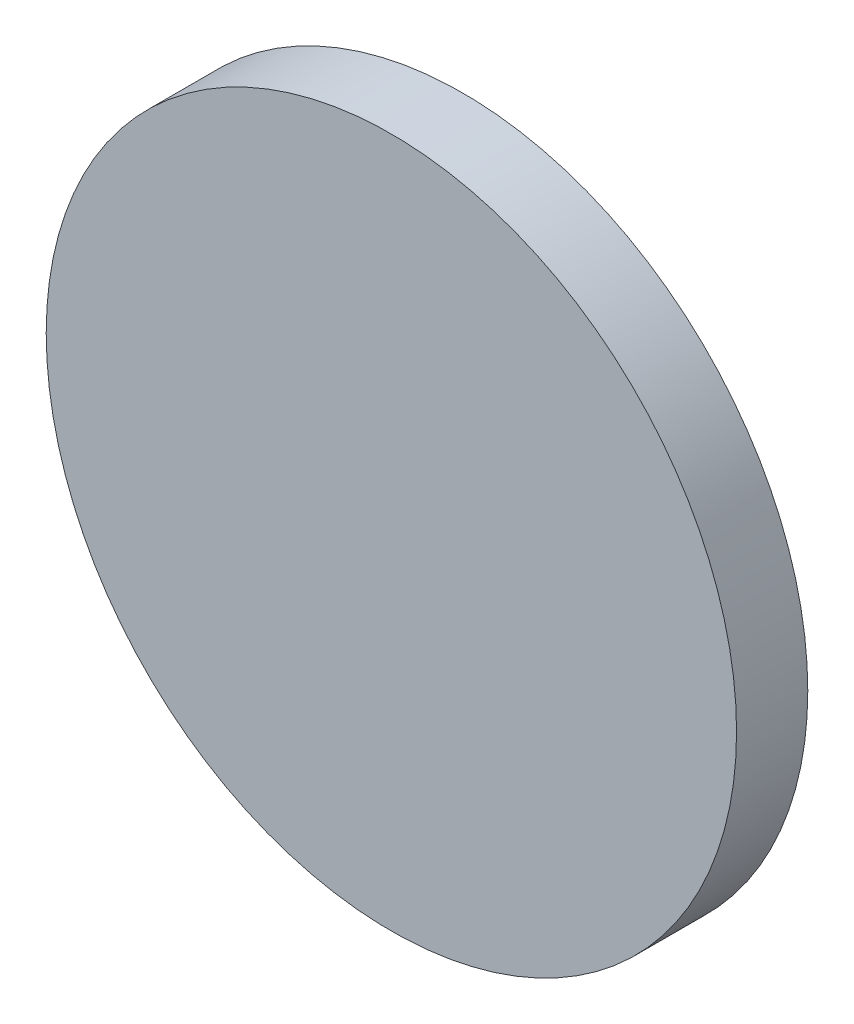
from build123d import *

# Parameters (mm, degrees)
SKETCH2_R           = 16.002
BOSS_EXTRUDE2_DEPTH = 3.302


with BuildPart() as part:
    # Sketch2 → Boss-Extrude2 (new body)
    with BuildSketch(Plane.XY):
        with Locations(Location((0, 0, 0), (0, 0, 180))):
            Circle(SKETCH2_R)
    extrude(amount=BOSS_EXTRUDE2_DEPTH)


solid = part.part
